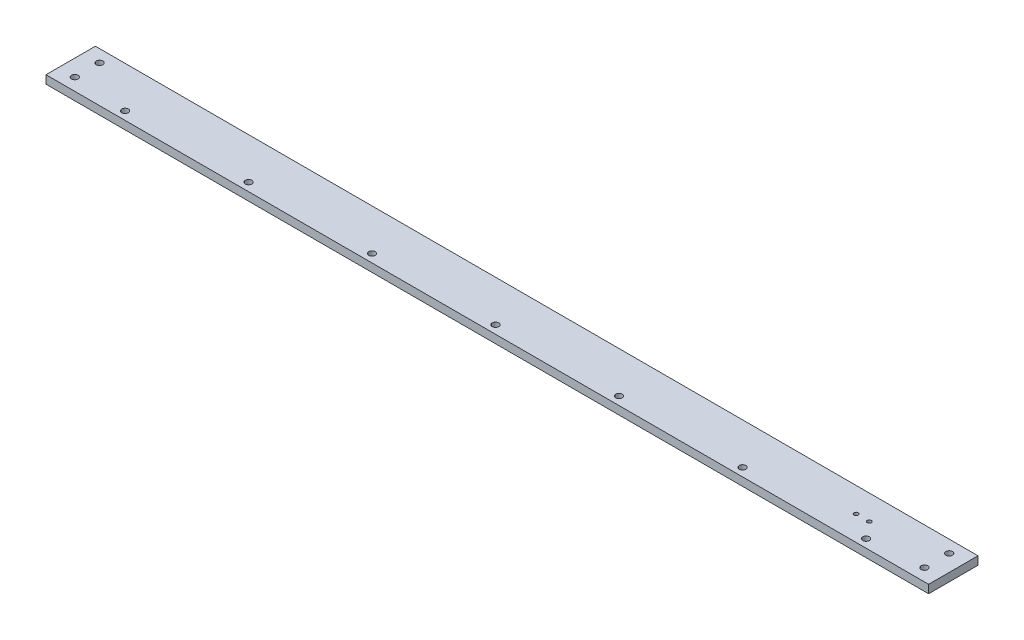
from build123d import *

# Parameters (mm, degrees)
SKETCH1_W                = 536
SKETCH1_H                = 30
BOSS_EXTRUDE1_DEPTH      = 5
F_4_0_4_DIAMETER_HOLE1_D = 4
M3_TAPPED_HOLE1_D        = 2.5
M3_TAPPED_HOLE1_DEPTH    = 7.5
M3_TAPPED_HOLE1_TIP      = 0.751075774


with BuildPart() as part:
    # Sketch1 → Boss-Extrude1 (new body)
    with BuildSketch(Plane(origin=(0, 0, 0), x_dir=(1, 0, 0), z_dir=(0, 1, 0))):
        Rectangle(SKETCH1_W, SKETCH1_H)
    extrude(amount=BOSS_EXTRUDE1_DEPTH)

    # Ø4.0 (4) Diameter Hole1 (through all)
    with Locations(Plane(origin=(-258, 5, -7.5), x_dir=(0, 0, 1), z_dir=(0, 1, 0))):
        with Locations((0, 0), (15, 0), (17.5, 33), (17.5, 108), (17.5, 183), (17.5, 258), (17.5, 333), (17.5, 408), (17.5, 483), (15, 516), (0, 516)):
            Hole(F_4_0_4_DIAMETER_HOLE1_D / 2)

    # M3 Tapped Hole1
    with Locations(Plane(origin=(216.980485857, 0, 0), x_dir=(0, 0, -1), z_dir=(0, -1, 0))):
        with Locations((0, 0), (0, -8)):
            Hole(M3_TAPPED_HOLE1_D / 2, depth=M3_TAPPED_HOLE1_DEPTH)
            with Locations((0, 0, -(M3_TAPPED_HOLE1_DEPTH + M3_TAPPED_HOLE1_TIP / 2))):  # 118° drill point
                Cone(0, M3_TAPPED_HOLE1_D / 2, M3_TAPPED_HOLE1_TIP, mode=Mode.SUBTRACT)


solid = part.part
